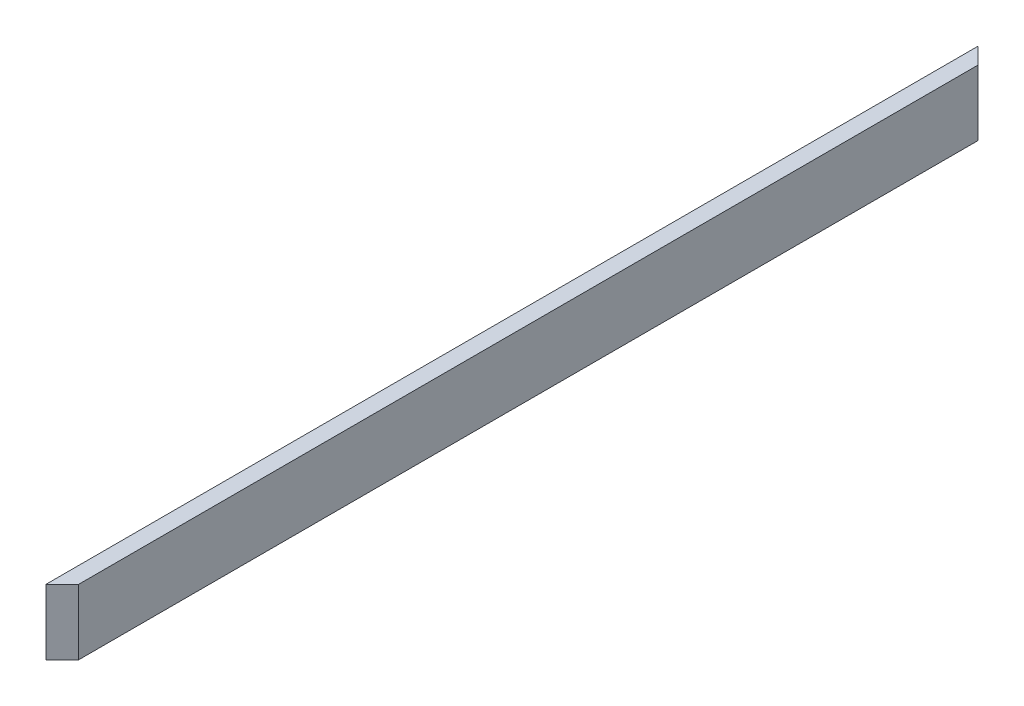
from build123d import *

# Parameters (mm, degrees)
ESQUISSE1_W             = 10
ESQUISSE1_H             = 40
BOSS_EXTRU_1_DEPTH      = 300
ENL_V_MAT_EXTRU_1_DEPTH = 303.820078595


with BuildPart() as part:
    # Esquisse1 → Boss.-Extru.1 (new, symmetric)
    with BuildSketch(Plane.XY):
        with Locations((-5, 20)):
            Rectangle(ESQUISSE1_W, ESQUISSE1_H)
    extrude(amount=BOSS_EXTRU_1_DEPTH, both=True)

    # Esquisse2 → Enlèv. mat.-Extru.1 (cut, symmetric)
    with BuildSketch(Plane.XZ):
        Polygon((0, 275), (-10, 285), (-10, 300), (0, 300), align=None)
    enl_v_mat_extru_1 = extrude(amount=ENL_V_MAT_EXTRU_1_DEPTH, both=True, mode=Mode.SUBTRACT)

    # Symétrie1: Enlèv. mat.-Extru.1 across plane
    add(enl_v_mat_extru_1.mirror(Plane.XY), mode=Mode.SUBTRACT)


solid = part.part
